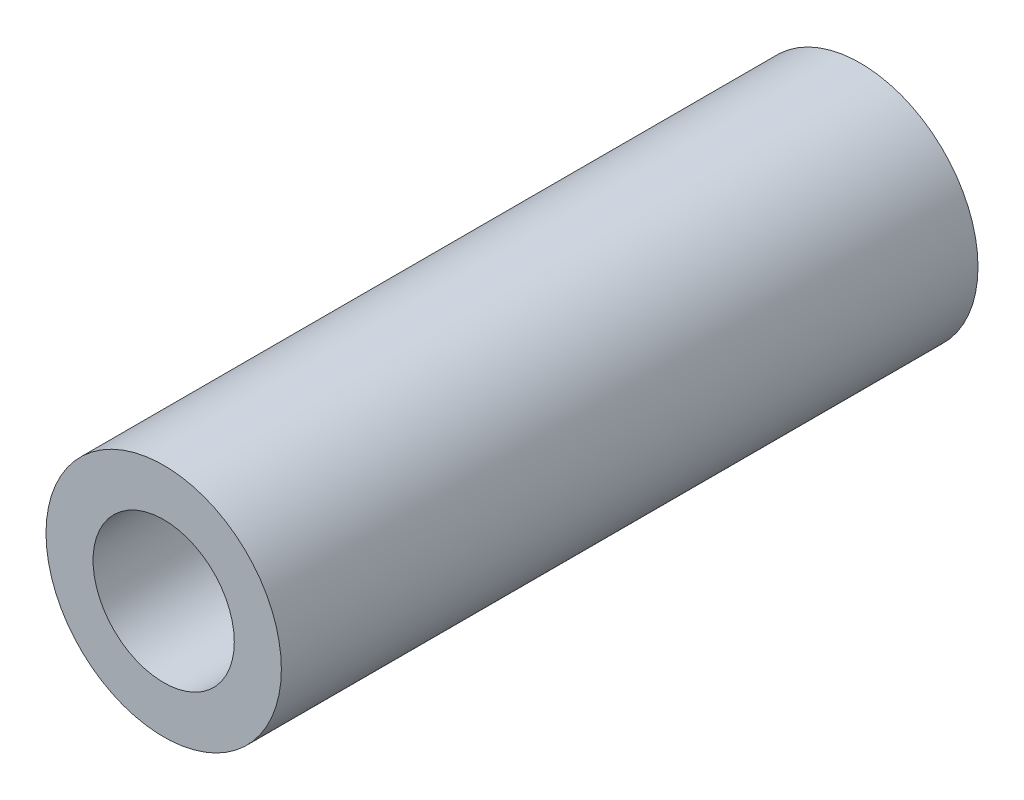
from build123d import *

# Parameters (mm, degrees)
SKETCH_1_R      = 5
SKETCH_1_R_2    = 3
EXTRUDE_1_DEPTH = 29.6


with BuildPart() as part:
    # ｽｹｯﾁ1 → ﾎﾞｽ - 押し出し1 (new body)
    with BuildSketch(Plane.XY):
        Circle(SKETCH_1_R)
        Circle(SKETCH_1_R_2, mode=Mode.SUBTRACT)
    extrude(amount=EXTRUDE_1_DEPTH)


solid = part.part
